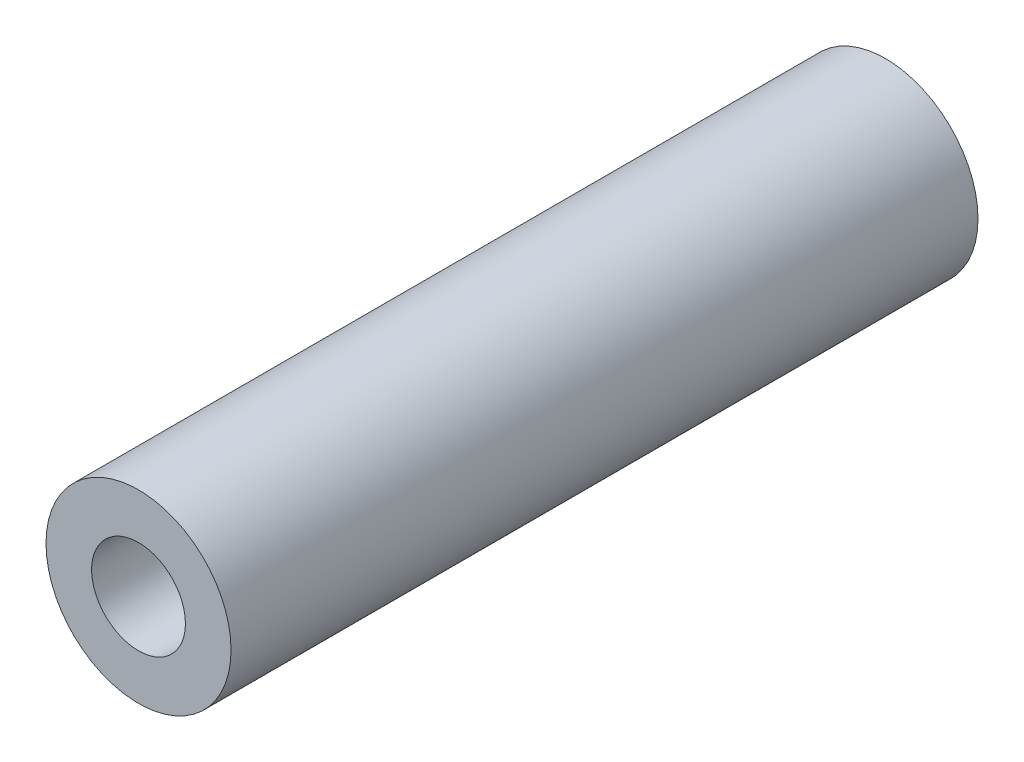
from build123d import *

# Parameters (mm, degrees)
ESQUISSE1_R        = 7.89
ESQUISSE1_R_2      = 4
BOSS_EXTRU_1_DEPTH = 63.7


with BuildPart() as part:
    # Esquisse1 → Boss.-Extru.1 (new body)
    with BuildSketch(Plane(origin=(0, 0, 0), x_dir=(0, 1, 0), z_dir=(0, 0, 1))):
        with Locations(Location((0, 0, 0), (0, 0, 270))):
            Circle(ESQUISSE1_R)
        with Locations(Location((0, 0, 0), (0, 0, 270))):
            Circle(ESQUISSE1_R_2, mode=Mode.SUBTRACT)
    extrude(amount=BOSS_EXTRU_1_DEPTH)


solid = part.part
